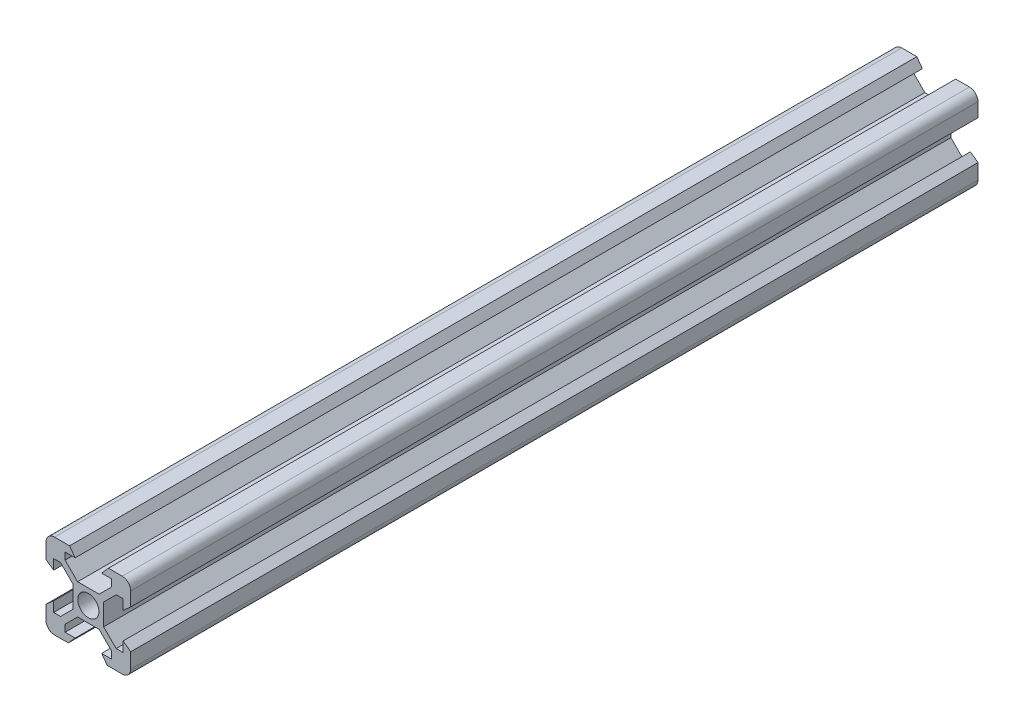
from build123d import *

# Parameters (mm, degrees)
SKETCH1_R           = 2.5
BOSS_EXTRUDE1_DEPTH = 200


with BuildPart() as part:
    # Sketch1 → Boss-Extrude1 (new body)
    with BuildSketch(Plane.XY):
        with BuildLine():
            Line((-4.725542729, -10), (-3.125, -8.2))
            Line((-3.125, -8.2), (-5.5, -8.2))
            Line((-5.5, -8.2), (-5.5, -6.560660172))
            Line((-5.5, -6.560660172), (-2.539339828, -3.6))
            Line((-2.539339828, -3.6), (2.539339828, -3.6))
            Line((2.539339828, -3.6), (5.5, -6.560660172))
            Line((5.5, -6.560660172), (5.5, -8.2))
            Line((5.5, -8.2), (3.125, -8.2))
            Line((3.125, -8.2), (4.434457271, -10))
            Line((4.434457271, -10), (8, -10))
            ThreePointArc((8, -10), (9.414213562, -9.414213562), (10, -8))
            Line((10, -8), (10, -4.434457271))
            Line((10, -4.434457271), (8.2, -3.125))
            Line((8.2, -3.125), (8.2, -5.5))
            Line((8.2, -5.5), (6.560660172, -5.5))
            Line((6.560660172, -5.5), (3.6, -2.539339828))
            Line((3.6, -2.539339828), (3.6, 2.539339828))
            Line((3.6, 2.539339828), (6.560660172, 5.5))
            Line((6.560660172, 5.5), (8.2, 5.5))
            Line((8.2, 5.5), (8.2, 3.125))
            Line((8.2, 3.125), (10, 4.725542729))
            Line((10, 4.725542729), (10, 8))
            ThreePointArc((10, 8), (9.414213562, 9.414213562), (8, 10))
            Line((8, 10), (4.725542729, 10))
            Line((4.725542729, 10), (3.125, 8.2))
            Line((3.125, 8.2), (5.5, 8.2))
            Line((5.5, 8.2), (5.5, 6.560660172))
            Line((5.5, 6.560660172), (2.539339828, 3.6))
            Line((2.539339828, 3.6), (-2.539339828, 3.6))
            Line((-2.539339828, 3.6), (-5.5, 6.560660172))
            Line((-5.5, 6.560660172), (-5.5, 8.2))
            Line((-5.5, 8.2), (-3.125, 8.2))
            Line((-3.125, 8.2), (-4.434457271, 10))
            Line((-4.434457271, 10), (-8, 10))
            ThreePointArc((-8, 10), (-9.414213562, 9.414213562), (-10, 8))
            Line((-10, 8), (-10, 4.434457271))
            Line((-10, 4.434457271), (-8.2, 3.125))
            Line((-8.2, 3.125), (-8.2, 5.5))
            Line((-8.2, 5.5), (-6.560660172, 5.5))
            Line((-6.560660172, 5.5), (-3.6, 2.539339828))
            Line((-3.6, 2.539339828), (-3.6, -2.539339828))
            Line((-3.6, -2.539339828), (-6.560660172, -5.5))
            Line((-6.560660172, -5.5), (-8.2, -5.5))
            Line((-8.2, -5.5), (-8.2, -3.125))
            Line((-8.2, -3.125), (-10, -4.725542729))
            Line((-10, -4.725542729), (-10, -8))
            ThreePointArc((-10, -8), (-9.414213562, -9.414213562), (-8, -10))
            Line((-8, -10), (-4.725542729, -10))
        make_face()
        Circle(SKETCH1_R, mode=Mode.SUBTRACT)
    extrude(amount=BOSS_EXTRUDE1_DEPTH)


solid = part.part
